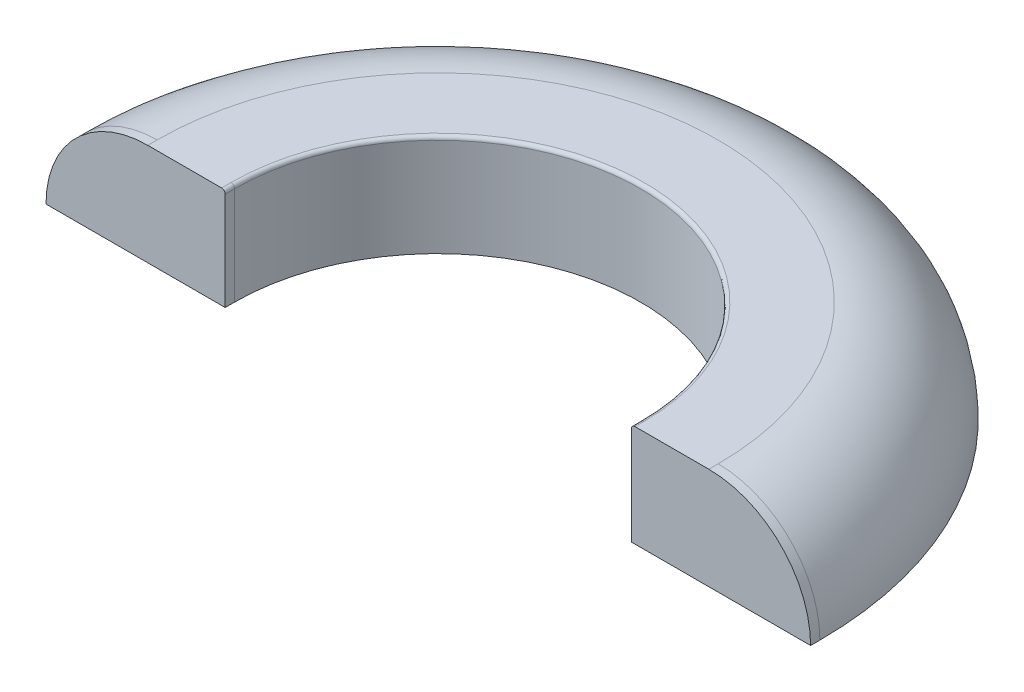
from build123d import *

# Parameters (mm, degrees)
BOSS_EXTRUDE1_DEPTH = 500
FILLET1_R           = 10
BOSS_EXTRUDE2_DEPTH = 26


with BuildPart() as part:
    # Sketch1 → Boss-Extrude1 (new body)
    with BuildSketch(Plane(origin=(0, 0, 0), x_dir=(1, 0, 0), z_dir=(0, 1, 0))):
        with BuildLine():
            Line((-566.6, 0), (-1066.6, 0))
            ThreePointArc((-1066.6, 0), (0, 1066.6), (1066.6, 0))
            Line((1066.6, 0), (566.6, 0))
            ThreePointArc((566.6, 0), (0, 566.6), (-566.6, 0))
        make_face()
    extrude(amount=BOSS_EXTRUDE1_DEPTH)

    # Fillet1
    fillet1_edges = [part.edges().sort_by_distance(p)[0] for p in [
        (0, 500, -1066.6),
        (0, 500, -566.6),
        (0, 0, -1066.6),
        (0, 0, -566.6),
    ]]
    fillet(fillet1_edges, radius=FILLET1_R)

    # Sketch2 → Cut-Revolve1 (revolve, cut)
    with BuildSketch(Plane.XY):
        with BuildLine():
            Line((-1066.6, 216), (-566.6, 216))
            Line((-566.6, 216), (-566.6, 0))
            Line((-566.6, 0), (-1145.861102691, 0))
            Line((-1145.861102691, 0), (-1145.861102691, 500))
            Line((-1145.861102691, 500), (-782.6, 500))
            ThreePointArc((-782.6, 500), (-983.418325857, 416.818325857), (-1066.6, 216))
        make_face()
    revolve(axis=Axis((0, 0, 0), (0, 1, 0)), mode=Mode.SUBTRACT)

    # Sketch3 → Boss-Extrude2 (add)
    with BuildSketch(Plane.XY):
        with BuildLine():
            Line((-782.6, 500), (-576.6, 500))
            ThreePointArc((-576.6, 500), (-569.528932188, 497.071067812), (-566.6, 490))
            Line((-566.6, 490), (-566.6, 216))
            Line((-566.6, 216), (-1066.6, 216))
            ThreePointArc((-1066.6, 216), (-983.418325857, 416.818325857), (-782.6, 500))
        make_face()
        with BuildLine():
            Line((576.6, 500), (782.6, 500))
            ThreePointArc((782.6, 500), (983.418325857, 416.818325857), (1066.6, 216))
            Line((1066.6, 216), (566.6, 216))
            Line((566.6, 216), (566.6, 490))
            ThreePointArc((566.6, 490), (569.528932188, 497.071067812), (576.6, 500))
        make_face()
    extrude(amount=BOSS_EXTRUDE2_DEPTH)


solid = part.part
